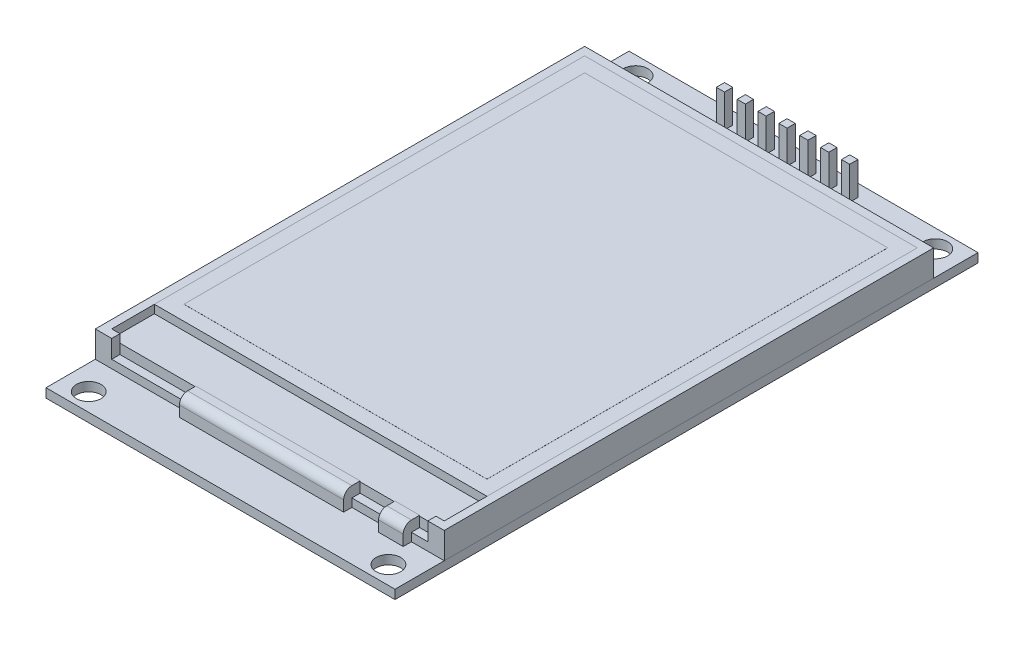
from build123d import *

# Parameters (mm, degrees)
SKETCH1_W                                  = 42.5
SKETCH1_H                                  = 71
BOSS_EXTRUDE1_DEPTH                        = 1.1
SKETCH7_R                                  = 1.5
CUT_EXTRUDE2_DEPTH                         = 42.388675988
MIRROR1_AT_THE_SECOND_PLANE_COPY_1_SKETC_R = 1.5
MIRROR1_AT_THE_SECOND_PLANE_COPY_1_DEPTH   = 42.388675988
BOSS_EXTRUDE5_START                        = -8
SKETCH8_W                                  = 1
SKETCH8_H                                  = 1
BOSS_EXTRUDE5_DEPTH                        = 12
LPATTERN1_COUNT                            = 4
LPATTERN1_PITCH                            = 2.54
LPATTERN1_COL_COUNT                        = 4
LPATTERN1_COL_PITCH                        = 2.54
SKETCH10_W                                 = 8.9
SKETCH10_H                                 = 18
PCB_COMPONENTS_DEPTH                       = 1.8
SKETCH2_W                                  = 42.5
SKETCH2_H                                  = 59.6
BOSS_EXTRUDE2_DEPTH                        = 3.2
SKETCH3_W                                  = 40.5
SKETCH3_H                                  = 57.6
CUT_EXTRUDE1_DEPTH                         = 43.863183503
SKETCH12_W                                 = 38.5
SKETCH12_H                                 = 2.2
CUT_EXTRUDE4_DEPTH                         = 1
SKETCH5_W                                  = 40.5
SKETCH5_H                                  = 57.6
BOSS_EXTRUDE3_DEPTH                        = 3.2
SKETCH9_W                                  = 40.5
SKETCH9_H                                  = 5.2
CUT_EXTRUDE3_DEPTH                         = 1
SKETCH6_W                                  = 36.9
SKETCH6_H                                  = 48.8
BOSS_EXTRUDE4_DEPTH                        = 0.01
SKETCH11_W                                 = 20
SKETCH11_H                                 = 2
BOSS_EXTRUDE7_DEPTH                        = 2.3
SKETCH11_W_2                               = 3
BOSS_EXTRUDE7_2_DEPTH                      = 2.3
FILLET1_R                                  = 1
FILLET2_R                                  = 1


with BuildPart() as part:
    # Sketch1 → Boss-Extrude1 (new body)
    with BuildSketch(Plane(origin=(0, 0, 0), x_dir=(1, 0, 0), z_dir=(0, 1, 0))):
        Rectangle(SKETCH1_W, SKETCH1_H)
    extrude(amount=BOSS_EXTRUDE1_DEPTH)

    # Sketch7 → Cut-Extrude2 (cut, through all)
    with BuildSketch(Plane(origin=(0, 1.1, 0), x_dir=(1, 0, 0), z_dir=(0, 1, 0))):
        with Locations(Location((-18.25, 33.3, 0), (0, 0, 270))):
            Circle(SKETCH7_R)
    cut_extrude2 = extrude(amount=-CUT_EXTRUDE2_DEPTH, mode=Mode.SUBTRACT)

    # Mirror1: Cut-Extrude2 across plane
    add(cut_extrude2.mirror(Plane.XY), mode=Mode.SUBTRACT)

    # Mirror1 at the second plane: Cut-Extrude2 across plane
    add(cut_extrude2.mirror(Plane(origin=(0, 0, 0), x_dir=(0, 0, 1), z_dir=(1, 0, 0))), mode=Mode.SUBTRACT)

    # Mirror1 at the second plane copy 1 sketc → Mirror1 at the second plane copy 1 (cut, through all)
    with BuildSketch(Plane(origin=(0, 1.1, 0), x_dir=(-1, 0, 0), z_dir=(0, 1, 0))):
        with Locations(Location((-18.25, 33.3, 0), (0, 0, 270))):
            Circle(MIRROR1_AT_THE_SECOND_PLANE_COPY_1_SKETC_R)
    extrude(amount=-MIRROR1_AT_THE_SECOND_PLANE_COPY_1_DEPTH, mode=Mode.SUBTRACT)

    # Sketch8 → Boss-Extrude5 (add)
    with BuildSketch(Plane(origin=(0, 1.1, 0), x_dir=(1, 0, 0), z_dir=(0, 1, 0)).offset(BOSS_EXTRUDE5_START)):
        with Locations((0, 33.5)):
            Rectangle(SKETCH8_W, SKETCH8_H)
    boss_extrude5 = extrude(amount=BOSS_EXTRUDE5_DEPTH)

    # LPattern1: Boss-Extrude5 ×4
    with Locations(*[(i * LPATTERN1_PITCH, 0, 0) for i in range(1, LPATTERN1_COUNT)]):
        add(boss_extrude5)

    # LPattern1 col: Boss-Extrude5 ×4
    with Locations(*[(-i * LPATTERN1_COL_PITCH, 0, 0) for i in range(1, LPATTERN1_COL_COUNT)]):
        add(boss_extrude5)


with BuildPart() as body_2:
    # Sketch10 → PCB components (new body)
    with BuildSketch(Plane.XZ):
        with Locations((-8.3, -15.5)):
            Rectangle(SKETCH10_W, SKETCH10_H)
    extrude(amount=PCB_COMPONENTS_DEPTH)


with BuildPart() as body_3:
    # Sketch2 → Boss-Extrude2 (new body)
    with BuildSketch(Plane(origin=(0, 1.1, 0), x_dir=(1, 0, 0), z_dir=(0, 1, 0))):
        with Locations((0, 0.3)):
            Rectangle(SKETCH2_W, SKETCH2_H)
    extrude(amount=BOSS_EXTRUDE2_DEPTH)

    # Sketch3 → Cut-Extrude1 (cut, through all)
    with BuildSketch(Plane(origin=(0, 4.3, 0), x_dir=(1, 0, 0), z_dir=(0, 1, 0))):
        with Locations((0, 0.3)):
            Rectangle(SKETCH3_W, SKETCH3_H)
    extrude(amount=-CUT_EXTRUDE1_DEPTH, mode=Mode.SUBTRACT)

    # Sketch12 → Cut-Extrude4 (cut)
    with BuildSketch(Plane.XY.offset(29.5)):
        with Locations((0, 3.2)):
            Rectangle(SKETCH12_W, SKETCH12_H)
    extrude(amount=-CUT_EXTRUDE4_DEPTH, mode=Mode.SUBTRACT)


with BuildPart() as body_4:
    # Sketch5 → Boss-Extrude3 (new body)
    with BuildSketch(Plane(origin=(0, 1.1, 0), x_dir=(1, 0, 0), z_dir=(0, 1, 0))):
        with Locations((0, 0.3)):
            Rectangle(SKETCH5_W, SKETCH5_H)
    extrude(amount=BOSS_EXTRUDE3_DEPTH)

    # Sketch9 → Cut-Extrude3 (cut)
    with BuildSketch(Plane(origin=(0, 4.3, 0), x_dir=(1, 0, 0), z_dir=(0, 1, 0))):
        with Locations((0, -25.9)):
            Rectangle(SKETCH9_W, SKETCH9_H)
    extrude(amount=-CUT_EXTRUDE3_DEPTH, mode=Mode.SUBTRACT)

    # Sketch6 → Boss-Extrude4 (add)
    with BuildSketch(Plane(origin=(0, 4.3, 0), x_dir=(1, 0, 0), z_dir=(0, 1, 0))):
        with Locations((0, 2.9)):
            Rectangle(SKETCH6_W, SKETCH6_H)
    extrude(amount=BOSS_EXTRUDE4_DEPTH)


with BuildPart() as body_5:
    # Sketch11 → Boss-Extrude7 (new body)
    with BuildSketch(Plane(origin=(0, 1.1, 0), x_dir=(1, 0, 0), z_dir=(0, 1, 0))):
        with Locations((0, -29.5)):
            Rectangle(SKETCH11_W, SKETCH11_H)
    extrude(amount=BOSS_EXTRUDE7_DEPTH)

    # Fillet1
    fillet1_edges = [body_5.edges().sort_by_distance(p)[0] for p in [
        (0, 3.4, 30.5),
    ]]
    fillet(fillet1_edges, radius=FILLET1_R)


with BuildPart() as body_6:
    # Sketch11 → Boss-Extrude7 2 (new body)
    with BuildSketch(Plane(origin=(0, 1.1, 0), x_dir=(1, 0, 0), z_dir=(0, 1, 0))):
        with Locations((15.75, -29.5)):
            Rectangle(SKETCH11_W_2, SKETCH11_H)
    extrude(amount=BOSS_EXTRUDE7_2_DEPTH)

    # Fillet2
    fillet2_edges = [body_6.edges().sort_by_distance(p)[0] for p in [
        (15.75, 3.4, 30.5),
    ]]
    fillet(fillet2_edges, radius=FILLET2_R)


solid = Compound([part.part, body_2.part, body_3.part, body_4.part, body_5.part, body_6.part])
